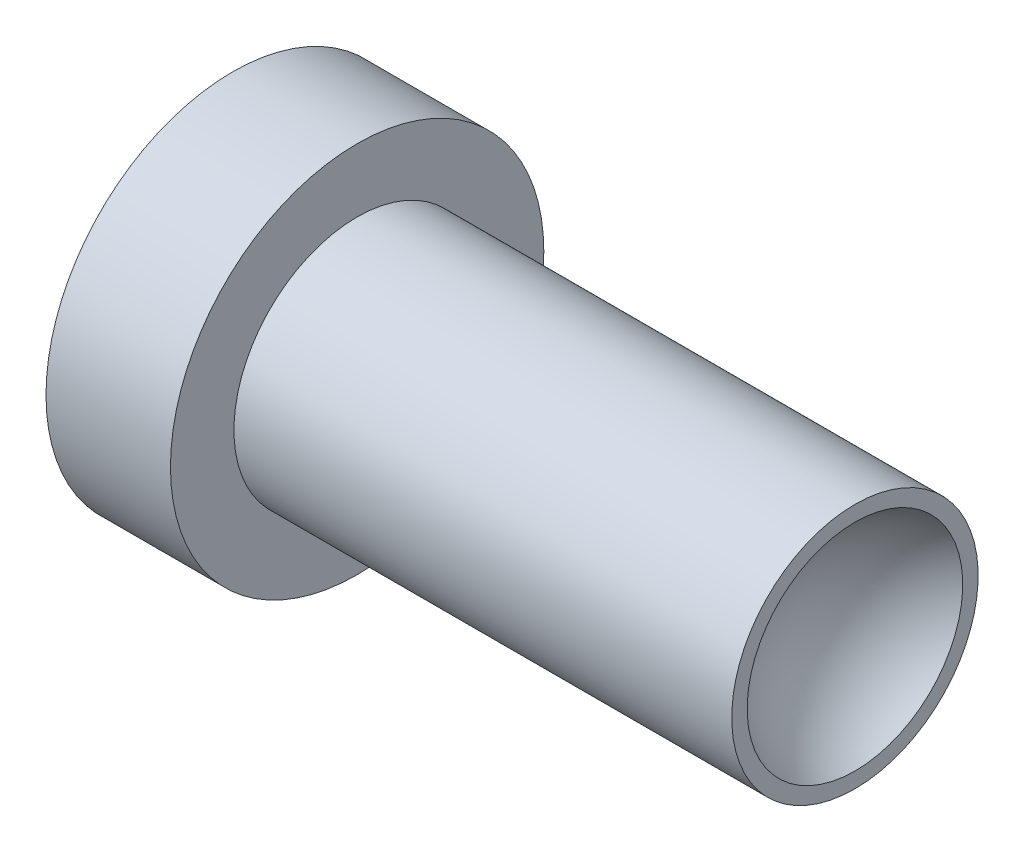
from build123d import *


with BuildPart() as part:
    # Sketch1 → Revolve1 (revolve)
    with BuildSketch(Plane.XY):
        Polygon((0, 0), (0, 19.05), (12.7, 19.05), (12.7, 12.573), (63.5, 12.573), (63.5, 0), align=None)
    revolve(axis=Axis((63.5, 0, 0), (-1, 0, 0)))

    # Sketch2 → Cut-Revolve1 (revolve, cut)
    with BuildSketch(Plane.XY, mode=Mode.PRIVATE) as cut_revolve1_sk:
        with BuildLine():
            Line((63.5, -10.998522628), (63.5, 0))
            Line((63.5, 0), (57.15, 0))
            ThreePointArc((57.15, 0), (58.851477372, -6.35), (63.5, -10.998522628))
        make_face()
    revolve(cut_revolve1_sk.sketch.rotate(Axis((63.5, 0, 0), (-1, 0, 0)), 180), axis=Axis((63.5, 0, 0), (-1, 0, 0)), mode=Mode.SUBTRACT)


solid = part.part
